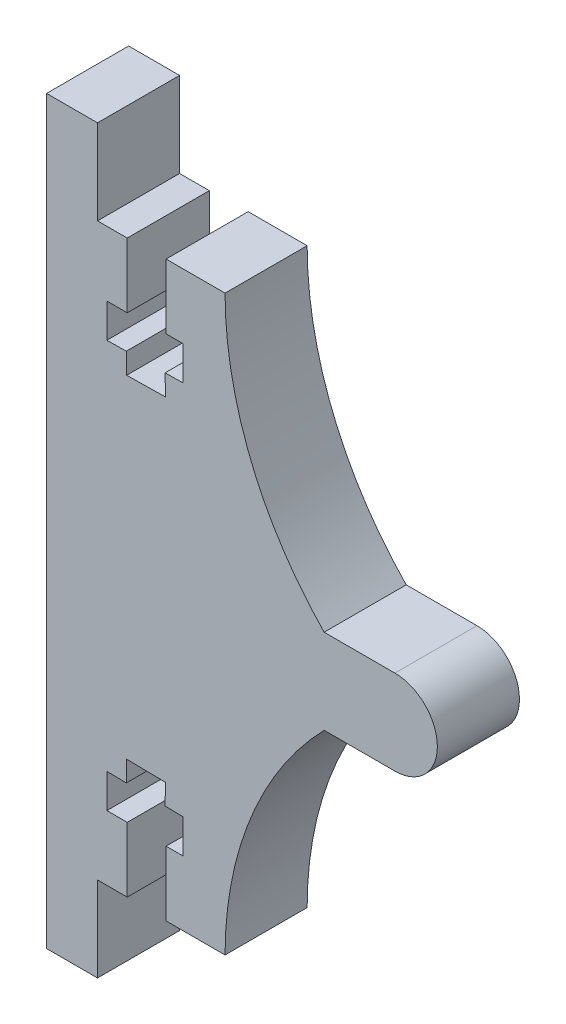
from build123d import *

# Parameters (mm, degrees)
BOSS_EXTRUDE1_DEPTH = 5.8


with BuildPart() as part:
    # Sketch1 → Boss-Extrude1 (new body)
    with BuildSketch(Plane.XY):
        with BuildLine():
            Line((640.899853243, 447.602981641), (645.899853243, 447.602981641))
            ThreePointArc((645.899853243, 447.602981641), (648.899853243, 444.602981641), (645.899853243, 441.602981641))
            Line((645.899853243, 441.602981641), (640.899853243, 441.602981641))
            ThreePointArc((640.899853243, 441.602981641), (635.71651299, 433.661076237), (633.899853243, 424.352981641))
            Line((633.899853243, 424.352981641), (629.732441047, 424.352981641))
            Line((629.732441047, 424.352981641), (629.732441047, 428.928887757))
            Line((629.732441047, 428.928887757), (630.944771309, 428.928887757))
            Line((630.944771309, 428.928887757), (630.942520898, 431.328937702))
            Line((630.942520898, 431.328937702), (629.664733055, 431.349424729))
            Line((629.664733055, 431.349424729), (629.688208222, 432.81358455))
            Line((629.688208222, 432.81358455), (626.946903544, 432.857536436))
            Line((626.946903544, 432.857536436), (626.923428377, 431.393376615))
            Line((626.923428377, 431.393376615), (625.548423101, 431.415422349))
            Line((625.548423101, 431.415422349), (625.550673512, 429.015372404))
            Line((625.550673512, 429.015372404), (626.988308144, 429.015372404))
            Line((626.988308144, 429.015372404), (626.988308144, 424.439466289))
            Line((626.988308144, 424.439466289), (624.888308144, 424.439466289))
            Line((624.888308144, 424.439466289), (624.888308144, 418.439466289))
            Line((624.888308144, 418.439466289), (621.288308144, 418.439466289))
            Line((621.288308144, 418.439466289), (621.288308144, 424.439466289))
            Line((621.288308144, 424.439466289), (621.288308144, 464.766496994))
            Line((621.288308144, 464.766496994), (621.288308144, 470.766496994))
            Line((621.288308144, 470.766496994), (624.888308144, 470.766496994))
            Line((624.888308144, 470.766496994), (624.888308144, 464.766496994))
            Line((624.888308144, 464.766496994), (626.988308144, 464.766496994))
            Line((626.988308144, 464.766496994), (626.988308144, 460.190590879))
            Line((626.988308144, 460.190590879), (625.550673512, 460.190590879))
            Line((625.550673512, 460.190590879), (625.548423101, 457.790540934))
            Line((625.548423101, 457.790540934), (626.923428377, 457.812586668))
            Line((626.923428377, 457.812586668), (626.946903544, 456.348426847))
            Line((626.946903544, 456.348426847), (629.688208222, 456.392378732))
            Line((629.688208222, 456.392378732), (629.664733055, 457.856538553))
            Line((629.664733055, 457.856538553), (630.942520898, 457.877025581))
            Line((630.942520898, 457.877025581), (630.944771309, 460.277075526))
            Line((630.944771309, 460.277075526), (629.732441047, 460.277075526))
            Line((629.732441047, 460.277075526), (629.732441047, 464.852981641))
            Line((629.732441047, 464.852981641), (633.899853243, 464.852981641))
            ThreePointArc((633.899853243, 464.852981641), (635.71651299, 455.544887046), (640.899853243, 447.602981641))
        make_face()
    extrude(amount=BOSS_EXTRUDE1_DEPTH)


solid = part.part
